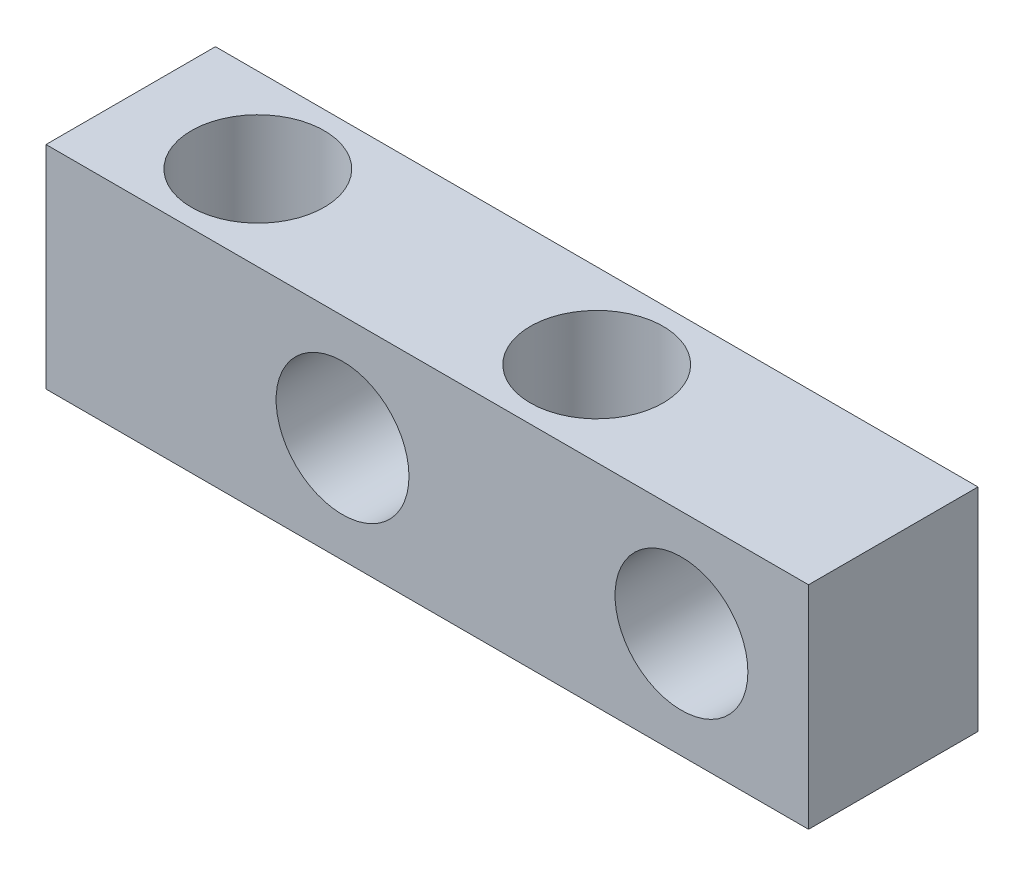
from build123d import *

# Parameters (mm, degrees)
SKETCH1_W               = 28.575
SKETCH1_H               = 7.9375
SKETCH1_R               = 2.4892
BOSS_EXTRUDE1_DEPTH     = 3.175
CUT_EXTRUDE1_DEPTH      = 16.164572457
CUT_EXTRUDE1_DEPTH_BACK = 16.164572457
SKETCH2_R               = 2.4892


with BuildPart() as part:
    # Sketch1 → Boss-Extrude1 (new, symmetric)
    with BuildSketch(Plane.XY):
        Rectangle(SKETCH1_W, SKETCH1_H)
        with Locations((-3.175, 0)):
            Circle(SKETCH1_R, mode=Mode.SUBTRACT)
        with Locations((9.525, 0)):
            Circle(SKETCH1_R, mode=Mode.SUBTRACT)
    extrude(amount=BOSS_EXTRUDE1_DEPTH, both=True)

    # Sketch2 → Cut-Extrude1 (cut, two sides: drawn at the far end of the back side and taken through both)
    with BuildSketch(Plane(origin=(0, 0, 0), x_dir=(1, 0, 0), z_dir=(0, 1, 0)).offset(-CUT_EXTRUDE1_DEPTH_BACK)):
        with Locations(Location((3.175, 0, 0), (0, 0, 270))):
            Circle(SKETCH2_R)
        with Locations(Location((-9.525, 0, 0), (0, 0, 270))):
            Circle(SKETCH2_R)
    extrude(amount=CUT_EXTRUDE1_DEPTH + CUT_EXTRUDE1_DEPTH_BACK, mode=Mode.SUBTRACT)


solid = part.part
